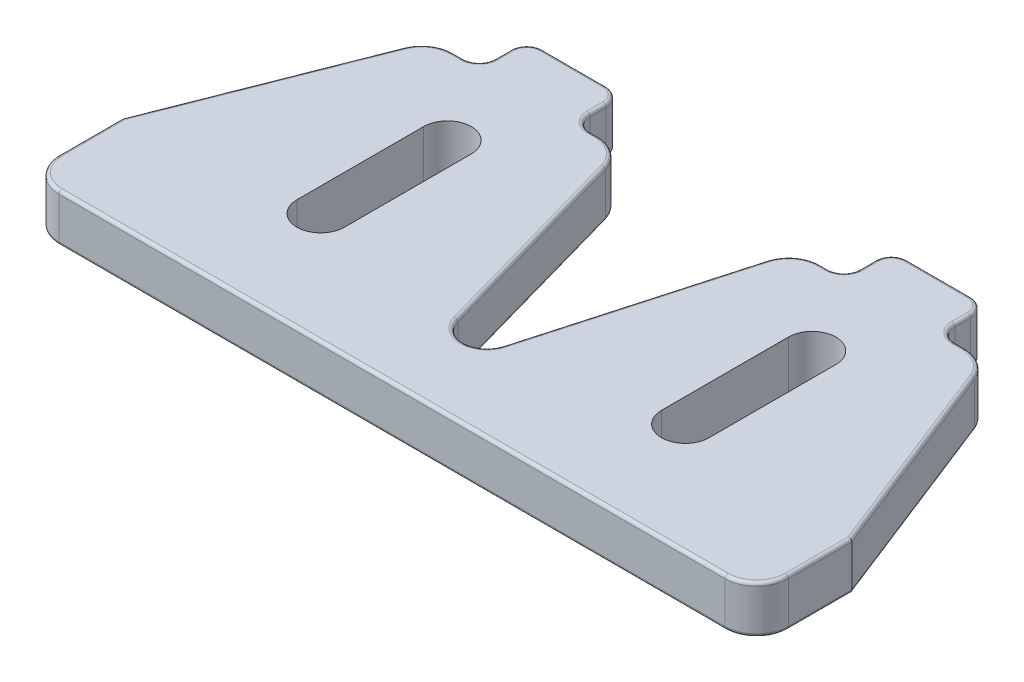
from build123d import *

# Parameters (mm, degrees)
BOSS_EXTRUDE1_DEPTH = 3
FILLET1_R           = 0.2


with BuildPart() as part:
    # Sketch1 → Boss-Extrude1 (new body)
    with BuildSketch(Plane(origin=(0, 0, 0), x_dir=(1, 0, 0), z_dir=(0, 1, 0))):
        with BuildLine():
            Line((21, 0), (-21, 0))
            ThreePointArc((-21, 0), (-22.414213562, 0.585786438), (-23, 2))
            Line((-23, 2), (-23, 6))
            Line((-23, 6), (-17.998415993, 18.731304745))
            ThreePointArc((-17.998415993, 18.731304745), (-17.263276738, 19.652665951), (-16.136913006, 20))
            Line((-16.136913006, 20), (-15.5, 20))
            ThreePointArc((-15.5, 20), (-14.792893219, 20.292893219), (-14.5, 21))
            Line((-14.5, 21), (-14.5, 22))
            ThreePointArc((-14.5, 22), (-14.207106781, 22.707106781), (-13.5, 23))
            Line((-13.5, 23), (-9.5, 23))
            ThreePointArc((-9.5, 23), (-8.792893219, 22.707106781), (-8.5, 22))
            Line((-8.5, 22), (-8.5, 21))
            ThreePointArc((-8.5, 21), (-8.207106781, 20.292893219), (-7.5, 20))
            Line((-7.5, 20), (-7.014660728, 20))
            ThreePointArc((-7.014660728, 20), (-5.807193949, 19.594372597), (-5.089508784, 18.542023978))
            Line((-5.089508784, 18.542023978), (-1.443863958, 5.593482017))
            ThreePointArc((-1.443863958, 5.593482017), (0, 4.5), (1.443863958, 5.593482017))
            Line((1.443863958, 5.593482017), (5.089508784, 18.542023978))
            ThreePointArc((5.089508784, 18.542023978), (5.807193949, 19.594372597), (7.014660728, 20))
            Line((7.014660728, 20), (7.5, 20))
            ThreePointArc((7.5, 20), (8.207106781, 20.292893219), (8.5, 21))
            Line((8.5, 21), (8.5, 22))
            ThreePointArc((8.5, 22), (8.792893219, 22.707106781), (9.5, 23))
            Line((9.5, 23), (13.5, 23))
            ThreePointArc((13.5, 23), (14.207106781, 22.707106781), (14.5, 22))
            Line((14.5, 22), (14.5, 21))
            ThreePointArc((14.5, 21), (14.792893219, 20.292893219), (15.5, 20))
            Line((15.5, 20), (16.136913006, 20))
            ThreePointArc((16.136913006, 20), (17.263276738, 19.652665951), (17.998415993, 18.731304745))
            Line((17.998415993, 18.731304745), (23, 6))
            Line((23, 6), (23, 2))
            ThreePointArc((23, 2), (22.414213562, 0.585786438), (21, 0))
        make_face()
        with BuildLine():
            Line((-13, 7), (-13, 15))
            ThreePointArc((-13, 15), (-11.5, 16.5), (-10, 15))
            Line((-10, 15), (-10, 7))
            ThreePointArc((-10, 7), (-11.5, 5.5), (-13, 7))
        make_face(mode=Mode.SUBTRACT)
        with BuildLine():
            Line((13, 7), (13, 15))
            ThreePointArc((13, 15), (11.5, 16.5), (10, 15))
            Line((10, 15), (10, 7))
            ThreePointArc((10, 7), (11.5, 5.5), (13, 7))
        make_face(mode=Mode.SUBTRACT)
    extrude(amount=BOSS_EXTRUDE1_DEPTH)

    # Fillet1
    fillet1_edges = [part.edges().sort_by_distance(p)[0] for p in [
        (-22.414213562, 3, -0.585786438),
        (0, 3, 0),
        (22.414213562, 3, -0.585786438),
        (23, 3, -4),
        (20.499207997, 3, -12.365652372),
        (17.263276738, 3, -19.652665951),
        (-17.263276738, 0, -19.652665951),
        (-15.818456503, 0, -20),
        (-14.792893219, 0, -20.292893219),
        (15.818456503, 3, -20),
        (-14.5, 0, -21.5),
        (-14.207106781, 0, -22.707106781),
        (-11.5, 0, -23),
        (-8.792893219, 0, -22.707106781),
        (-8.5, 0, -21.5),
        (-8.207106781, 0, -20.292893219),
        (-7.257330364, 0, -20),
        (-5.807193949, 0, -19.594372597),
        (14.792893219, 3, -20.292893219),
        (-3.266686371, 0, -12.067752997),
        (0, 0, -4.5),
        (3.266686371, 0, -12.067752997),
        (5.807193949, 0, -19.594372597),
        (7.257330364, 0, -20),
        (8.207106781, 0, -20.292893219),
        (8.5, 0, -21.5),
        (14.5, 3, -21.5),
        (8.792893219, 0, -22.707106781),
        (11.5, 0, -23),
        (14.207106781, 0, -22.707106781),
        (14.5, 0, -21.5),
        (14.792893219, 0, -20.292893219),
        (15.818456503, 0, -20),
        (17.263276738, 0, -19.652665951),
        (20.499207997, 0, -12.365652372),
        (14.207106781, 3, -22.707106781),
        (23, 0, -4),
        (22.414213562, 0, -0.585786438),
        (0, 0, 0),
        (-22.414213562, 0, -0.585786438),
        (-23, 0, -4),
        (-20.499207997, 0, -12.365652372),
        (-20.499207997, 3, -12.365652372),
        (11.5, 3, -23),
        (8.792893219, 3, -22.707106781),
        (8.5, 3, -21.5),
        (8.207106781, 3, -20.292893219),
        (7.257330364, 3, -20),
        (5.807193949, 3, -19.594372597),
        (3.266686371, 3, -12.067752997),
        (0, 3, -4.5),
        (-3.266686371, 3, -12.067752997),
        (-5.807193949, 3, -19.594372597),
        (-23, 3, -4),
        (-7.257330364, 3, -20),
        (-8.207106781, 3, -20.292893219),
        (-8.5, 3, -21.5),
        (-8.792893219, 3, -22.707106781),
        (-11.5, 3, -23),
        (-14.207106781, 3, -22.707106781),
        (-14.5, 3, -21.5),
        (-14.792893219, 3, -20.292893219),
        (-15.818456503, 3, -20),
        (-17.263276738, 3, -19.652665951),
    ]]
    fillet(fillet1_edges, radius=FILLET1_R)


solid = part.part
